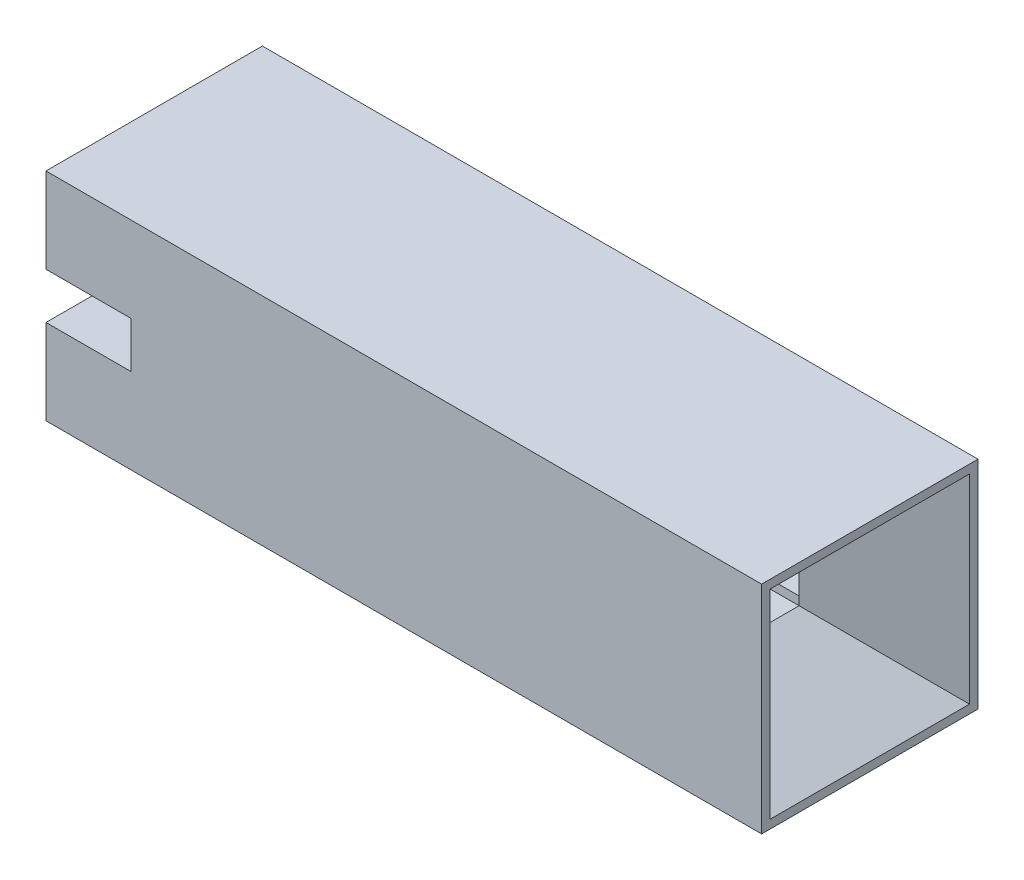
from build123d import *

# Parameters (mm, degrees)
SKETCH1_W           = 8.4
SKETCH1_H           = 2.54
BOSS_EXTRUDE1_DEPTH = 2.54
CUT_EXTRUDE1_REACH  = 11.136
SKETCH2_W           = 0.74
SKETCH2_H           = 0.74
CHAMFER2_SIZE       = 0.8
CHAMFER2_SIZE2      = 1.2
SKETCH3_W           = 2.54
SKETCH3_H           = 0.54
CUT_EXTRUDE2_DEPTH  = 1
CUT_EXTRUDE4_START  = -6.2
SKETCH5_W           = 1.74
SKETCH5_H           = 0.54
CUT_EXTRUDE4_DEPTH  = 6.2


with BuildPart() as part:
    # Sketch1 → Boss-Extrude1 (new body)
    with BuildSketch(Plane.XY):
        with Locations((4.2, 1.27)):
            Rectangle(SKETCH1_W, SKETCH1_H)
    extrude(amount=BOSS_EXTRUDE1_DEPTH)

    # Sketch2 → Cut-Extrude1 (cut, up to next)
    with BuildSketch(Plane(origin=(8.4, 0, 0), x_dir=(0, 0, -1), z_dir=(1, 0, 0)), mode=Mode.PRIVATE) as cut_extrude1_sk1:
        with Locations((-1.27, 1.27)):
            Rectangle(SKETCH2_W, SKETCH2_H)
    cut_extrude1_tool1 = extrude(cut_extrude1_sk1.sketch, amount=-CUT_EXTRUDE1_REACH, mode=Mode.PRIVATE) & part.part
    add(cut_extrude1_tool1.solids().sort_by_distance((8.4, 1.27, 1.27))[0], mode=Mode.SUBTRACT)

    # Chamfer2
    chamfer2_edges = [part.edges().sort_by_distance(p)[0] for p in [
        (8.4, 1.27, 1.64),
        (8.4, 0.9, 1.27),
        (8.4, 1.27, 0.9),
        (8.4, 1.64, 1.27),
    ]]
    chamfer2_side = [part.faces().sort_by_distance(p)[0] for p in [
        (8.4, 0.035921024, 1.27),
    ]]
    chamfer(chamfer2_edges, length=CHAMFER2_SIZE, length2=CHAMFER2_SIZE2, reference=chamfer2_side[0])

    # Sketch3 → Cut-Extrude2 (cut)
    with BuildSketch(Plane.ZY):
        with Locations((1.27, 1.27)):
            Rectangle(SKETCH3_W, SKETCH3_H)
    extrude(amount=-CUT_EXTRUDE2_DEPTH, mode=Mode.SUBTRACT)

    # Sketch5 → Cut-Extrude4 (cut)
    with BuildSketch(Plane.ZY.offset(-1).offset(CUT_EXTRUDE4_START)):
        with Locations((1.27, 1.27)):
            Rectangle(SKETCH5_W, SKETCH5_H)
    extrude(amount=CUT_EXTRUDE4_DEPTH, mode=Mode.SUBTRACT)


solid = part.part
